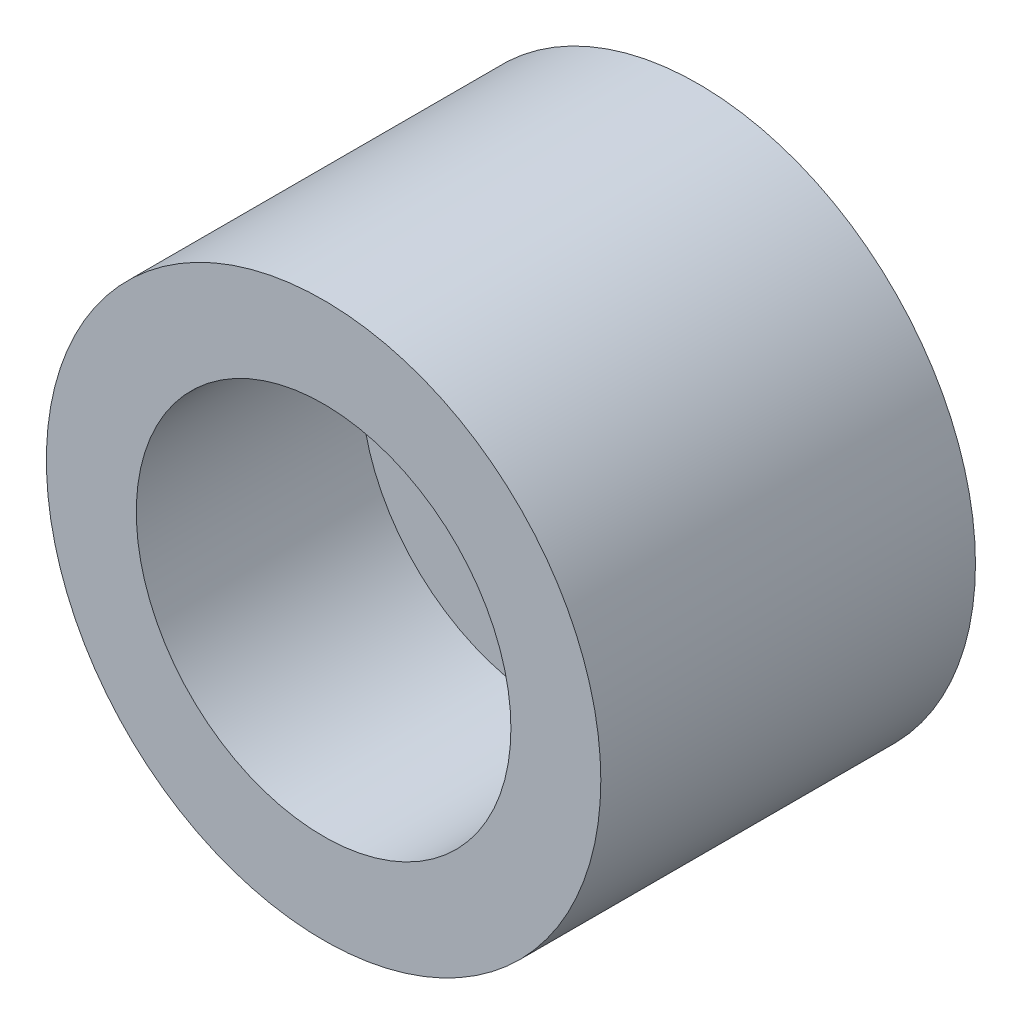
from build123d import *

# Parameters (mm, degrees)
SKETCH_1_R          = 3.7
EXTRUDE_1_DEPTH     = 5
SKETCH_2_R          = 2.5
CUT_EXTRUDE_1_DEPTH = 3
SKETCH_3_R          = 1.5
CUT_EXTRUDE_2_DEPTH = 2


with BuildPart() as part:
    # 草图1 → 凸台-拉伸1 (new body)
    with BuildSketch(Plane.XY):
        Circle(SKETCH_1_R)
    extrude(amount=EXTRUDE_1_DEPTH)

    # 草图2 → 切除-拉伸1 (cut)
    with BuildSketch(Plane.XY.offset(5)):
        Circle(SKETCH_2_R)
    extrude(amount=-CUT_EXTRUDE_1_DEPTH, mode=Mode.SUBTRACT)

    # 草图3 → 切除-拉伸2 (cut)
    with BuildSketch(Plane.XY.offset(2)):
        Circle(SKETCH_3_R)
    extrude(amount=-CUT_EXTRUDE_2_DEPTH, mode=Mode.SUBTRACT)


solid = part.part
